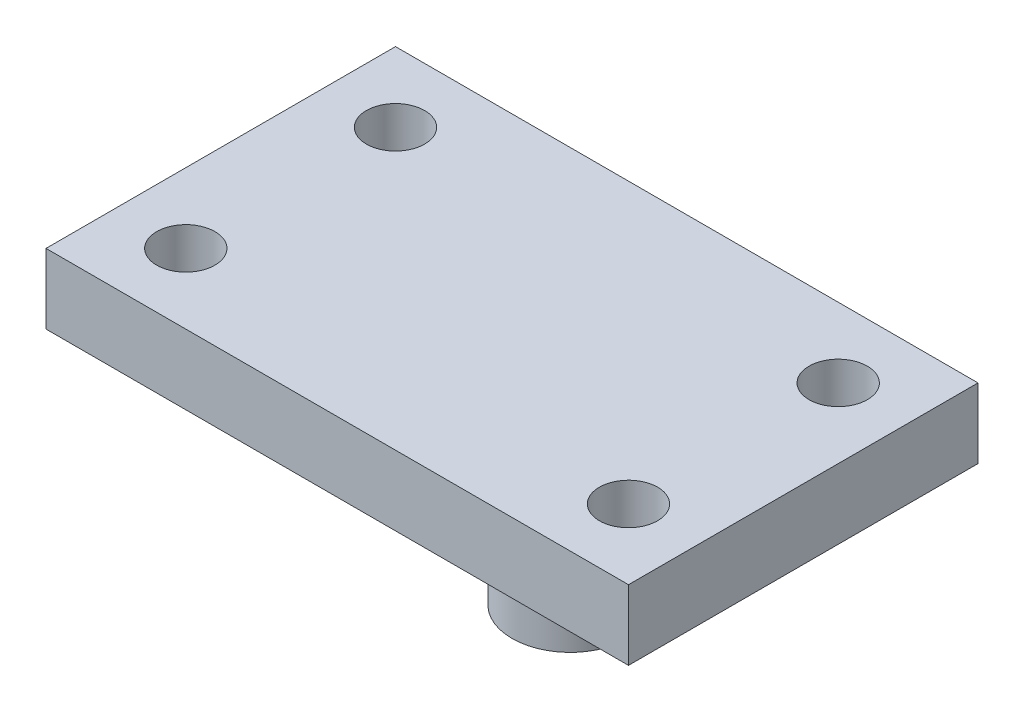
from build123d import *

# Parameters (mm, degrees)
SKETCH2_W           = 250
SKETCH2_H           = 150
BOSS_EXTRUDE1_DEPTH = 15
SKETCH3_R           = 12.5
CUT_EXTRUDE1_DEPTH  = 149.828760661
SKETCH4_R           = 25
BOSS_EXTRUDE2_DEPTH = 90


with BuildPart() as part:
    # Sketch2 → Boss-Extrude1 (new, symmetric)
    with BuildSketch(Plane(origin=(0, 0, 0), x_dir=(1, 0, 0), z_dir=(0, 1, 0))):
        Rectangle(SKETCH2_W, SKETCH2_H)
    extrude(amount=BOSS_EXTRUDE1_DEPTH, both=True)

    # Sketch3 → Cut-Extrude1 (cut, through all)
    with BuildSketch(Plane(origin=(0, 15, 0), x_dir=(1, 0, 0), z_dir=(0, 1, 0))):
        with Locations(Location((-95, -45, 0), (0, 0, 270))):
            Circle(SKETCH3_R)
        with Locations(Location((-95, 45, 0), (0, 0, 270))):
            Circle(SKETCH3_R)
        with Locations(Location((95, -45, 0), (0, 0, 90))):
            Circle(SKETCH3_R)
        with Locations(Location((95, 45, 0), (0, 0, 90))):
            Circle(SKETCH3_R)
    extrude(amount=-CUT_EXTRUDE1_DEPTH, mode=Mode.SUBTRACT)

    # Sketch4 → Boss-Extrude2 (add)
    with BuildSketch(Plane.XZ.offset(15)):
        with Locations(Location((0, -25, 0), (0, 0, 90))):
            Circle(SKETCH4_R)
    extrude(amount=BOSS_EXTRUDE2_DEPTH)


solid = part.part
